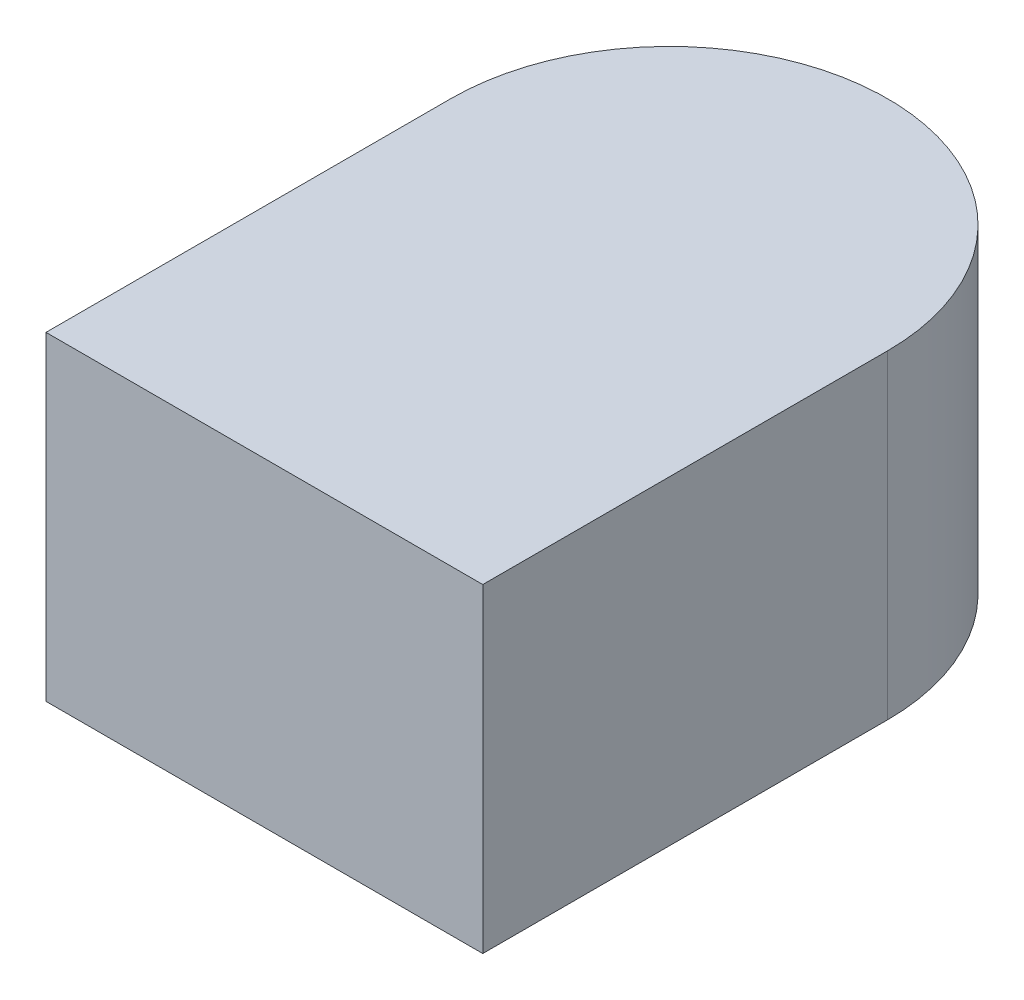
from build123d import *

# Parameters (mm, degrees)
BOSS_EXTRUDE1_DEPTH = 30
FILLET1_R           = 1


with BuildPart() as part:
    # Sketch2 → Boss-Extrude1 (new body)
    with BuildSketch(Plane(origin=(0, 0, 0), x_dir=(1, 0, 0), z_dir=(0, 1, 0))):
        with BuildLine():
            ThreePointArc((38, 35), (17.5, 55.5), (-3, 35))
            Line((-3, 35), (-3, -3))
            Line((-3, -3), (38, -3))
            Line((38, -3), (38, 35))
        make_face()
    extrude(amount=BOSS_EXTRUDE1_DEPTH)

    # Sketch2<9> → Cut-Loft1 section 0
    with BuildSketch(Plane(origin=(0, 0, 0), x_dir=(1, 0, 0), z_dir=(0, 1, 0))):
        with BuildLine():
            Line((0, 0), (0, 35))
            ThreePointArc((0, 35), (17.5, 52.5), (35, 35))
            Line((35, 35), (35, 0))
            Line((35, 0), (0, 0))
        make_face()
    # Sketch3 → Cut-Loft1 section 1
    with BuildSketch(Plane(origin=(0, 0.77, 0), x_dir=(-1, 0, 0), z_dir=(0, -1, 0))):
        with BuildLine():
            Line((-33.75, 1.5), (-1.25, 1.5))
            Line((-1.25, 1.5), (-1.25, 35))
            ThreePointArc((-1.25, 35), (-17.5, 51.25), (-33.75, 35))
            Line((-33.75, 35), (-33.75, 1.5))
        make_face()
    loft(mode=Mode.SUBTRACT)

    # Fillet1
    fillet1_edges = [part.edges().sort_by_distance(p)[0] for p in [
        (1.25, 0.77, -18.25),
        (33.75, 0.77, -18.25),
        (17.5, 0.77, -1.5),
        (17.5, 0.77, -51.25),
    ]]
    fillet(fillet1_edges, radius=FILLET1_R)


solid = part.part
